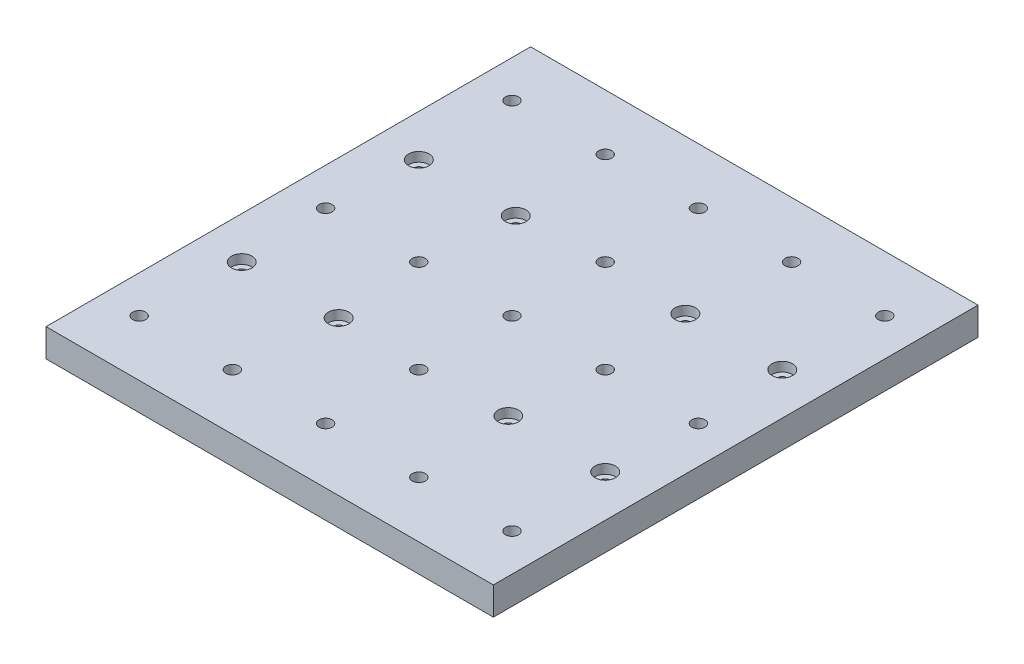
from build123d import *

# Parameters (mm, degrees)
CROQUIS1_W              = 240
CROQUIS1_H              = 260
SALIENTE_EXTRUIR1_DEPTH = 15
CROQUIS6_R              = 2.55
CORTAR_EXTRUIR3_DEPTH   = 178.552809046
CROQUIS7_R              = 5.5
CORTAR_EXTRUIR4_DEPTH   = 5
CROQUIS8_R              = 3.5
CORTAR_EXTRUIR5_DEPTH   = 178.552809046


with BuildPart() as part:
    # Croquis1 → Saliente-Extruir1 (new body)
    with BuildSketch(Plane(origin=(0, 0, 0), x_dir=(1, 0, 0), z_dir=(0, 1, 0))):
        Rectangle(CROQUIS1_W, CROQUIS1_H)
    extrude(amount=SALIENTE_EXTRUIR1_DEPTH)

    # Croquis6 → Cortar-Extruir3 (cut, through all)
    with BuildSketch(Plane.XZ):
        with Locations(Location((-45.5, -47.5, 0), (0, 0, 270))):
            Circle(CROQUIS6_R)
        with Locations(Location((-97.5, -47.5, 0), (0, 0, 270))):
            Circle(CROQUIS6_R)
        with Locations(Location((-97.5, 47.5, 0), (0, 0, 270))):
            Circle(CROQUIS6_R)
        with Locations(Location((-45.5, 47.5, 0), (0, 0, 270))):
            Circle(CROQUIS6_R)
        with Locations(Location((45.5, 47.5, 0), (0, 0, 270))):
            Circle(CROQUIS6_R)
        with Locations(Location((97.5, 47.5, 0), (0, 0, 270))):
            Circle(CROQUIS6_R)
        with Locations(Location((45.5, -47.5, 0), (0, 0, 270))):
            Circle(CROQUIS6_R)
        with Locations(Location((97.5, -47.5, 0), (0, 0, 270))):
            Circle(CROQUIS6_R)
    extrude(amount=-CORTAR_EXTRUIR3_DEPTH, mode=Mode.SUBTRACT)

    # Croquis7 → Cortar-Extruir4 (cut)
    with BuildSketch(Plane(origin=(0, 15, 0), x_dir=(1, 0, 0), z_dir=(0, 1, 0))):
        with Locations(Location((-97.5, 47.5, 0), (0, 0, 270))):
            Circle(CROQUIS7_R)
        with Locations(Location((-45.5, 47.5, 0), (0, 0, 270))):
            Circle(CROQUIS7_R)
        with Locations(Location((-97.5, -47.5, 0), (0, 0, 270))):
            Circle(CROQUIS7_R)
        with Locations(Location((-45.5, -47.5, 0), (0, 0, 270))):
            Circle(CROQUIS7_R)
        with Locations(Location((45.5, -47.5, 0), (0, 0, 270))):
            Circle(CROQUIS7_R)
        with Locations(Location((97.5, -47.5, 0), (0, 0, 270))):
            Circle(CROQUIS7_R)
        with Locations(Location((97.5, 47.5, 0), (0, 0, 270))):
            Circle(CROQUIS7_R)
        with Locations(Location((45.5, 47.5, 0), (0, 0, 270))):
            Circle(CROQUIS7_R)
    extrude(amount=-CORTAR_EXTRUIR4_DEPTH, mode=Mode.SUBTRACT)

    # Croquis8 → Cortar-Extruir5 (cut, through all)
    with BuildSketch(Plane(origin=(0, 15, 0), x_dir=(1, 0, 0), z_dir=(0, 1, 0))):
        with Locations(Location((-100, 100, 0), (0, 0, 270))):
            Circle(CROQUIS8_R)
        with Locations(Location((-50, 100, 0), (0, 0, 270))):
            Circle(CROQUIS8_R)
        with Locations(Location((0, 100, 0), (0, 0, 270))):
            Circle(CROQUIS8_R)
        with Locations(Location((50, 100, 0), (0, 0, 270))):
            Circle(CROQUIS8_R)
        with Locations(Location((100, 100, 0), (0, 0, 270))):
            Circle(CROQUIS8_R)
        with Locations(Location((0, 50, 0), (0, 0, 270))):
            Circle(CROQUIS8_R)
        with Locations(Location((-50, 0, 0), (0, 0, 270))):
            Circle(CROQUIS8_R)
        with Locations(Location((0, 0, 0), (0, 0, 270))):
            Circle(CROQUIS8_R)
        with Locations(Location((50, 0, 0), (0, 0, 270))):
            Circle(CROQUIS8_R)
        with Locations(Location((100, 0, 0), (0, 0, 270))):
            Circle(CROQUIS8_R)
        with Locations(Location((0, -50, 0), (0, 0, 270))):
            Circle(CROQUIS8_R)
        with Locations(Location((-50, -100, 0), (0, 0, 270))):
            Circle(CROQUIS8_R)
        with Locations(Location((0, -100, 0), (0, 0, 270))):
            Circle(CROQUIS8_R)
        with Locations(Location((50, -100, 0), (0, 0, 270))):
            Circle(CROQUIS8_R)
        with Locations(Location((100, -100, 0), (0, 0, 270))):
            Circle(CROQUIS8_R)
        with Locations(Location((-100, 0, 0), (0, 0, 270))):
            Circle(CROQUIS8_R)
        with Locations(Location((-100, -100, 0), (0, 0, 270))):
            Circle(CROQUIS8_R)
    extrude(amount=-CORTAR_EXTRUIR5_DEPTH, mode=Mode.SUBTRACT)


solid = part.part
